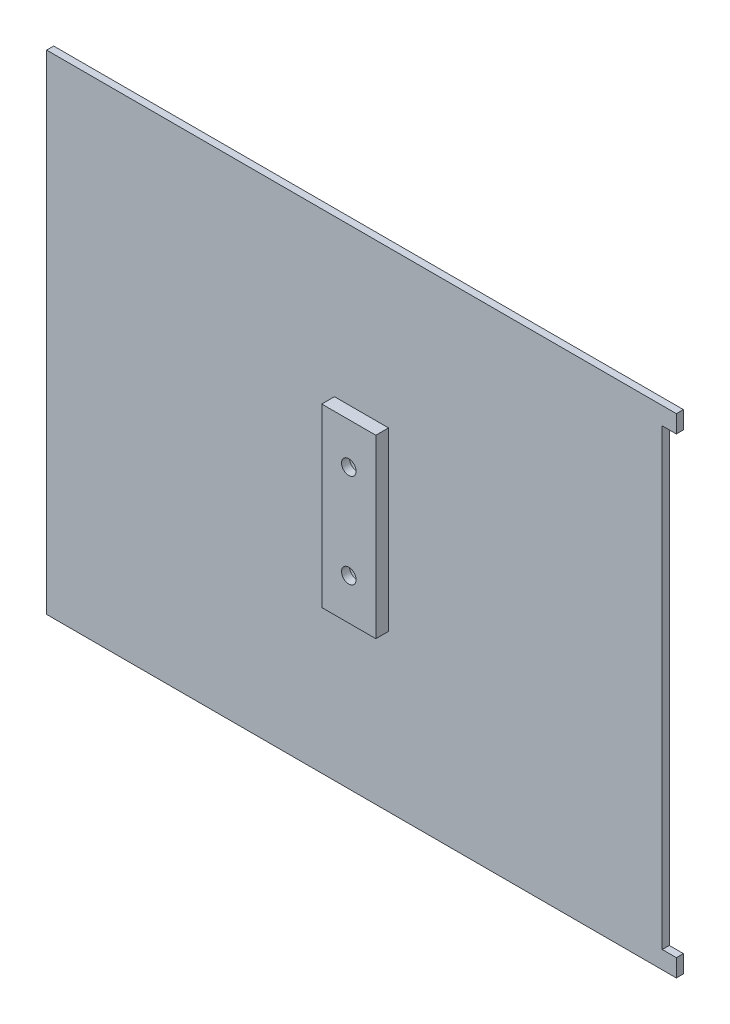
from build123d import *

# Parameters (mm, degrees)
EXTRUDE_2_DEPTH     = 1.5
SKETCH_2_W          = 11.5
SKETCH_2_H          = 37.5
EXTRUDE_3_DEPTH     = 2.7
SKETCH_3_R          = 3.1
CUT_EXTRUDE_1_DEPTH = 2.5
SKETCH_4_R          = 1.55
CUT_EXTRUDE_2_DEPTH = 2.5


with BuildPart() as part:
    # Эскиз1 → Бобышка-Вытянуть2 (new body)
    with BuildSketch(Plane.XY):
        Polygon((-67, -52), (67, -52), (67, -48.25), (64, -48.25), (64, 48.25), (67, 48.25), (67, 52), (-67, 52), align=None)
    extrude(amount=EXTRUDE_2_DEPTH)

    # Эскиз2 → Бобышка-Вытянуть3 (add)
    with BuildSketch(Plane.XY.offset(1.5)):
        Rectangle(SKETCH_2_W, SKETCH_2_H)
    extrude(amount=EXTRUDE_3_DEPTH)

    # Эскиз3 → Вырез-Вытянуть1 (cut)
    with BuildSketch(Plane(origin=(0, 0, 0), x_dir=(-1, 0, 0), z_dir=(0, 0, -1))):
        with Locations((0, -10)):
            Circle(SKETCH_3_R)
        with Locations((0, 10)):
            Circle(SKETCH_3_R)
    extrude(amount=-CUT_EXTRUDE_1_DEPTH, mode=Mode.SUBTRACT)

    # Эскиз4 → Вырез-Вытянуть2 (cut)
    with BuildSketch(Plane(origin=(0, 0, 2.5), x_dir=(-1, 0, 0), z_dir=(0, 0, -1))):
        with Locations((0, -10)):
            Circle(SKETCH_4_R)
        with Locations((0, 10)):
            Circle(SKETCH_4_R)
    extrude(amount=-CUT_EXTRUDE_2_DEPTH, mode=Mode.SUBTRACT)


solid = part.part
